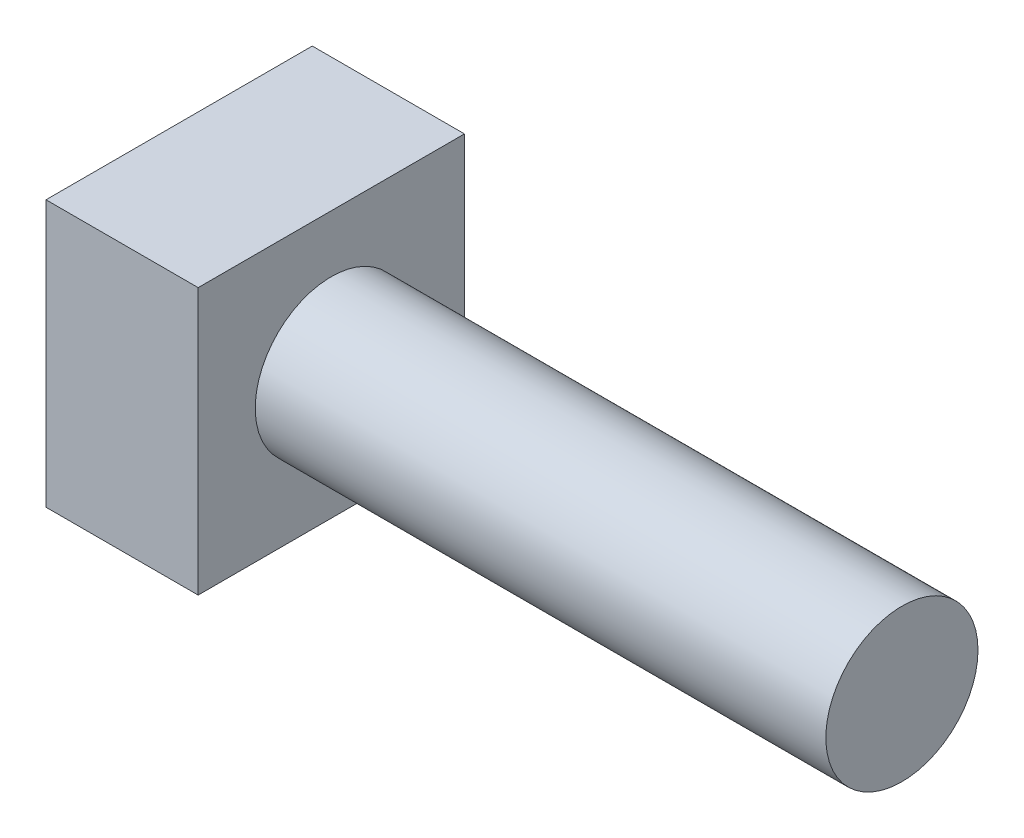
from build123d import *

# Parameters (mm, degrees)
SKETCH3_W           = 7
SKETCH3_H           = 7
BOSS_EXTRUDE2_DEPTH = 4
SKETCH4_R           = 2
BOSS_EXTRUDE3_DEPTH = 15


with BuildPart() as part:
    # Sketch3 → Boss-Extrude2 (new body)
    with BuildSketch(Plane(origin=(0, 0, 0), x_dir=(0, 0, -1), z_dir=(1, 0, 0))):
        Rectangle(SKETCH3_W, SKETCH3_H)
    extrude(amount=BOSS_EXTRUDE2_DEPTH)

    # Sketch4 → Boss-Extrude3 (add)
    with BuildSketch(Plane(origin=(4, 0, 0), x_dir=(0, 0, -1), z_dir=(1, 0, 0))):
        Circle(SKETCH4_R)
    extrude(amount=BOSS_EXTRUDE3_DEPTH)


solid = part.part
